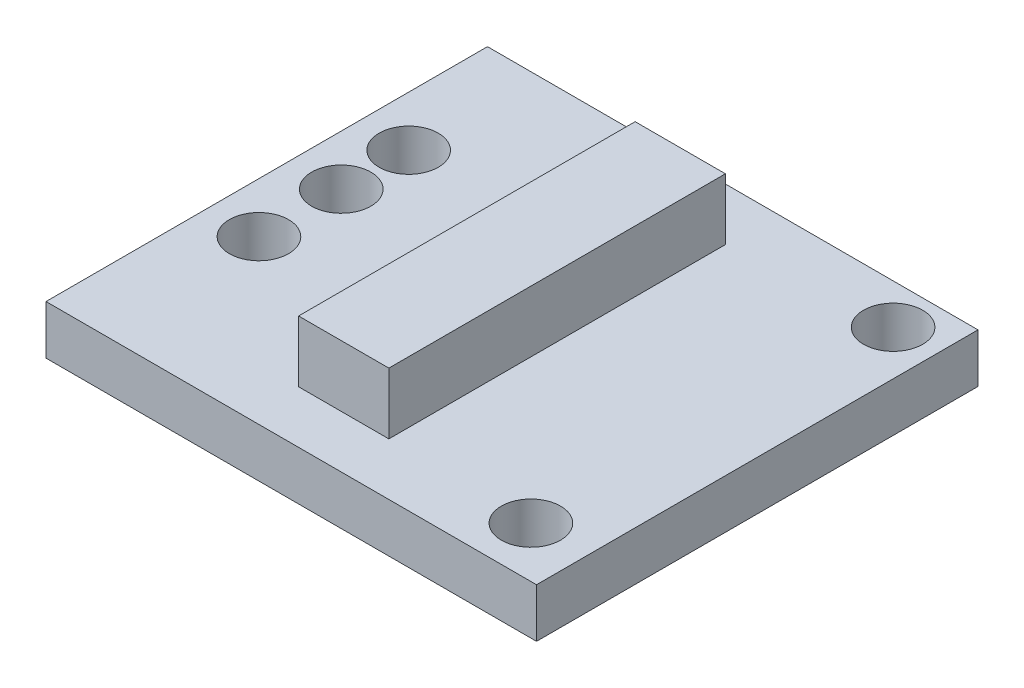
from build123d import *

# Parameters (mm, degrees)
SKETCH1_W           = 10
SKETCH1_H           = 9
SKETCH1_R           = 0.603114575
BOSS_EXTRUDE1_DEPTH = 1
SKETCH2_W           = 1.840309862
SKETCH2_H           = 6.861155246
BOSS_EXTRUDE2_DEPTH = 1.25


with BuildPart() as part:
    # Sketch1 → Boss-Extrude1 (new body)
    with BuildSketch(Plane(origin=(0, 0, 0), x_dir=(1, 0, 0), z_dir=(0, 1, 0))):
        Rectangle(SKETCH1_W, SKETCH1_H)
        with Locations(Location((-3.974491731, -1.184022837, 0), (0, 0, 270))):
            Circle(SKETCH1_R, mode=Mode.SUBTRACT)
        with Locations(Location((-3.974491731, 0.493456275, 0), (0, 0, 270))):
            Circle(SKETCH1_R, mode=Mode.SUBTRACT)
        with Locations(Location((-3.974491731, 1.868439153, 0), (0, 0, 270))):
            Circle(SKETCH1_R, mode=Mode.SUBTRACT)
        with Locations(Location((4.08905372, 3.680148348, 0), (0, 0, 270))):
            Circle(SKETCH1_R, mode=Mode.SUBTRACT)
        with Locations(Location((3.855346006, -3.469811406, 0), (0, 0, 270))):
            Circle(SKETCH1_R, mode=Mode.SUBTRACT)
    extrude(amount=BOSS_EXTRUDE1_DEPTH)

    # Sketch2 → Boss-Extrude2 (add)
    with BuildSketch(Plane(origin=(0, 1, 0), x_dir=(1, 0, 0), z_dir=(0, 1, 0))):
        Rectangle(SKETCH2_W, SKETCH2_H)
    extrude(amount=BOSS_EXTRUDE2_DEPTH)


solid = part.part
